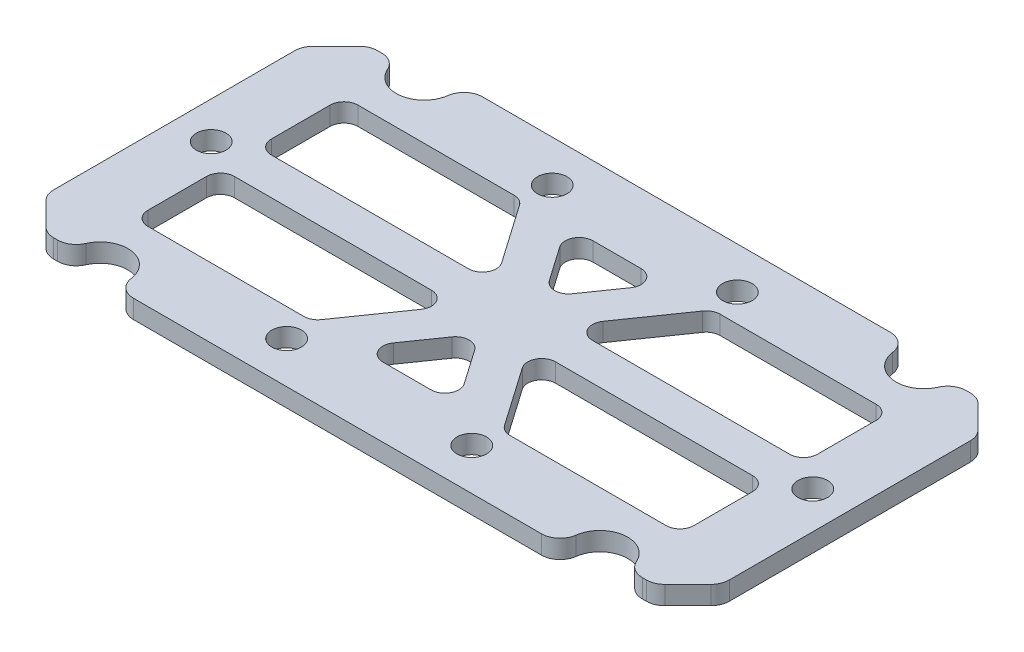
from build123d import *

# Parameters (mm, degrees)
SKETCH_1_W          = 73
SKETCH_1_H          = 37.7
SKETCH_1_R          = 1.6
EXTRUDE_1_DEPTH     = 2
SKETCH_2_W          = 59
SKETCH_2_H          = 22.7
CUT_EXTRUDE_1_DEPTH = 10
SKETCH_3_W          = 59
SKETCH_3_H          = 4
EXTRUDE_1_2_DEPTH   = 2
CUT_EXTRUDE_START   = -2
SKETCH_4_R          = 1.6
CUT_EXTRUDE_2_DEPTH = 2
FILLET_2_R          = 1.5
CHAMFER_1_SIZE      = 5
SKETCH_6_R          = 3
CUT_EXTRUDE_3_DEPTH = 10
CUT_EXTRUDE_4_DEPTH = 10
FILLET_3_R          = 2


with BuildPart() as part:
    # 草图1 → Extrude 1 (new body)
    with BuildSketch(Plane(origin=(0, 0, 0), x_dir=(1, 0, 0), z_dir=(0, 1, 0))):
        Rectangle(SKETCH_1_W, SKETCH_1_H)
        with Locations(Location((10, -14.35, 0), (0, 0, 270))):
            Circle(SKETCH_1_R, mode=Mode.SUBTRACT)
        with Locations(Location((-10, -14.35, 0), (0, 0, 270))):
            Circle(SKETCH_1_R, mode=Mode.SUBTRACT)
        with Locations(Location((-10, 14.35, 0), (0, 0, 270))):
            Circle(SKETCH_1_R, mode=Mode.SUBTRACT)
        with Locations(Location((10, 14.35, 0), (0, 0, 270))):
            Circle(SKETCH_1_R, mode=Mode.SUBTRACT)
        with Locations(Location((-32.5, 0, 0), (0, 0, 270))):
            Circle(SKETCH_1_R, mode=Mode.SUBTRACT)
        with Locations(Location((32.5, 0, 0), (0, 0, 270))):
            Circle(SKETCH_1_R, mode=Mode.SUBTRACT)
    extrude(amount=EXTRUDE_1_DEPTH)

    # 草图2 → 切除-拉伸1 (cut)
    with BuildSketch(Plane(origin=(0, 2, 0), x_dir=(1, 0, 0), z_dir=(0, 1, 0))):
        Rectangle(SKETCH_2_W, SKETCH_2_H)
    extrude(amount=-CUT_EXTRUDE_1_DEPTH, mode=Mode.SUBTRACT)

    # 草图3 → Extrude 1 2 (add)
    with BuildSketch(Plane(origin=(0, 2, 0), x_dir=(1, 0, 0), z_dir=(0, 1, 0))):
        Rectangle(SKETCH_3_W, SKETCH_3_H)
        Polygon((-11.640877602, 13.206531288), (8.359122398, -15.493468712), (11.640877602, -13.206531288), (-8.359122398, 15.493468712), align=None)
        Polygon((8.359122398, 15.493468712), (-11.640877602, -13.206531288), (-8.359122398, -15.493468712), (11.640877602, 13.206531288), align=None)
    extrude(amount=-EXTRUDE_1_2_DEPTH)

    # 草图4 → 切除-拉伸2 (cut)
    with BuildSketch(Plane(origin=(0, 2, 0), x_dir=(1, 0, 0), z_dir=(0, 1, 0)).offset(CUT_EXTRUDE_START)):
        with Locations(Location((10, -14.35, 0), (0, 0, 270))):
            Circle(SKETCH_4_R)
        with Locations(Location((-10, -14.35, 0), (0, 0, 270))):
            Circle(SKETCH_4_R)
        with Locations(Location((10, 14.35, 0), (0, 0, 270))):
            Circle(SKETCH_4_R)
        with Locations(Location((-10, 14.35, 0), (0, 0, 270))):
            Circle(SKETCH_4_R)
    extrude(amount=CUT_EXTRUDE_2_DEPTH, mode=Mode.SUBTRACT)

    # 圆角2
    fillet_2_edges = [part.edges().sort_by_distance(p)[0] for p in [
        (-3.831448133, 1, 2),
        (0, 1, -3.498128071),
        (3.831448133, 1, -2),
        (3.831448133, 1, 2),
        (29.5, 1, 2),
        (-29.5, 1, 2),
        (-3.831448133, 1, -2),
        (-29.5, 1, -2),
        (29.5, 1, -2),
        (29.5, 1, -11.35),
        (29.5, 1, 11.35),
        (-29.5, 1, 11.35),
        (-29.5, 1, -11.35),
        (-10.347127575, 1, -11.35),
        (10.347127575, 1, -11.35),
        (5.471687756, 1, -11.35),
        (-5.471687756, 1, -11.35),
        (-5.471687756, 1, 11.35),
        (-10.347127575, 1, 11.35),
        (10.347127575, 1, 11.35),
        (5.471687756, 1, 11.35),
        (0, 1, 3.498128071),
    ]]
    fillet(fillet_2_edges, radius=FILLET_2_R)

    # 倒角1
    chamfer_1_edges = [part.edges().sort_by_distance(p)[0] for p in [
        (36.5, 1, 18.85),
        (-36.5, 1, 18.85),
        (-36.5, 1, -18.85),
        (36.5, 1, -18.85),
    ]]
    chamfer(chamfer_1_edges, length=CHAMFER_1_SIZE)

    # 草图6 → 切除-拉伸3 (cut)
    with BuildSketch(Plane(origin=(0, 2, 0), x_dir=(1, 0, 0), z_dir=(0, 1, 0))):
        with Locations((27, 17.5)):
            Circle(SKETCH_6_R)
        with Locations((27, -17.5)):
            Circle(SKETCH_6_R)
        with Locations((-27, -17.5)):
            Circle(SKETCH_6_R)
        with Locations((-27, 17.5)):
            Circle(SKETCH_6_R)
    extrude(amount=-CUT_EXTRUDE_3_DEPTH, mode=Mode.SUBTRACT)

    # 草图7 → 切除-拉伸4 (cut)
    with BuildSketch(Plane(origin=(0, 2, 0), x_dir=(1, 0, 0), z_dir=(0, 1, 0))):
        with BuildLine():
            Line((30, -17.5), (32.85, -17.5))
            Line((32.85, -17.5), (31.5, -18.85))
            Line((31.5, -18.85), (29.679085665, -18.85))
            ThreePointArc((29.679085665, -18.85), (29.91866896, -18.193809414), (30, -17.5))
        make_face()
        with BuildLine():
            Line((24, -17.5), (24, -18.85))
            Line((24, -18.85), (24.320914335, -18.85))
            ThreePointArc((24.320914335, -18.85), (24.08133104, -18.193809414), (24, -17.5))
        make_face()
        with BuildLine():
            Line((24.320914335, 18.85), (24, 18.85))
            Line((24, 18.85), (24, 17.5))
            ThreePointArc((24, 17.5), (24.08133104, 18.193809414), (24.320914335, 18.85))
        make_face()
        with BuildLine():
            Line((31.5, 18.85), (32.85, 17.5))
            Line((32.85, 17.5), (30, 17.5))
            ThreePointArc((30, 17.5), (29.91866896, 18.193809414), (29.679085665, 18.85))
            Line((29.679085665, 18.85), (31.5, 18.85))
        make_face()
        with BuildLine():
            Line((-30, 17.5), (-32.85, 17.5))
            Line((-32.85, 17.5), (-31.5, 18.85))
            Line((-31.5, 18.85), (-29.679085665, 18.85))
            ThreePointArc((-29.679085665, 18.85), (-29.91866896, 18.193809414), (-30, 17.5))
        make_face()
        with BuildLine():
            Line((-24, 17.5), (-24, 18.85))
            Line((-24, 18.85), (-24.320914335, 18.85))
            ThreePointArc((-24.320914335, 18.85), (-24.08133104, 18.193809414), (-24, 17.5))
        make_face()
        with BuildLine():
            Line((-24.320914335, -18.85), (-24, -18.85))
            Line((-24, -18.85), (-24, -17.5))
            ThreePointArc((-24, -17.5), (-24.08133104, -18.193809414), (-24.320914335, -18.85))
        make_face()
        with BuildLine():
            Line((-31.5, -18.85), (-32.85, -17.5))
            Line((-32.85, -17.5), (-30, -17.5))
            ThreePointArc((-30, -17.5), (-29.91866896, -18.193809414), (-29.679085665, -18.85))
            Line((-29.679085665, -18.85), (-31.5, -18.85))
        make_face()
    extrude(amount=-CUT_EXTRUDE_4_DEPTH, mode=Mode.SUBTRACT)

    # 圆角3
    fillet_3_edges = [part.edges().sort_by_distance(p)[0] for p in [
        (-36.5, 1, -13.85),
        (-36.5, 1, 13.85),
        (36.5, 1, 13.85),
        (36.5, 1, -13.85),
        (-32.85, 1, 17.5),
        (-30, 1, 17.5),
        (24, 1, 18.85),
        (30, 1, 17.5),
        (32.85, 1, 17.5),
        (32.85, 1, -17.5),
        (30, 1, -17.5),
        (24, 1, -18.85),
        (-24, 1, -18.85),
        (-30, 1, -17.5),
        (-32.85, 1, -17.5),
        (-24, 1, 18.85),
    ]]
    fillet(fillet_3_edges, radius=FILLET_3_R)


solid = part.part
